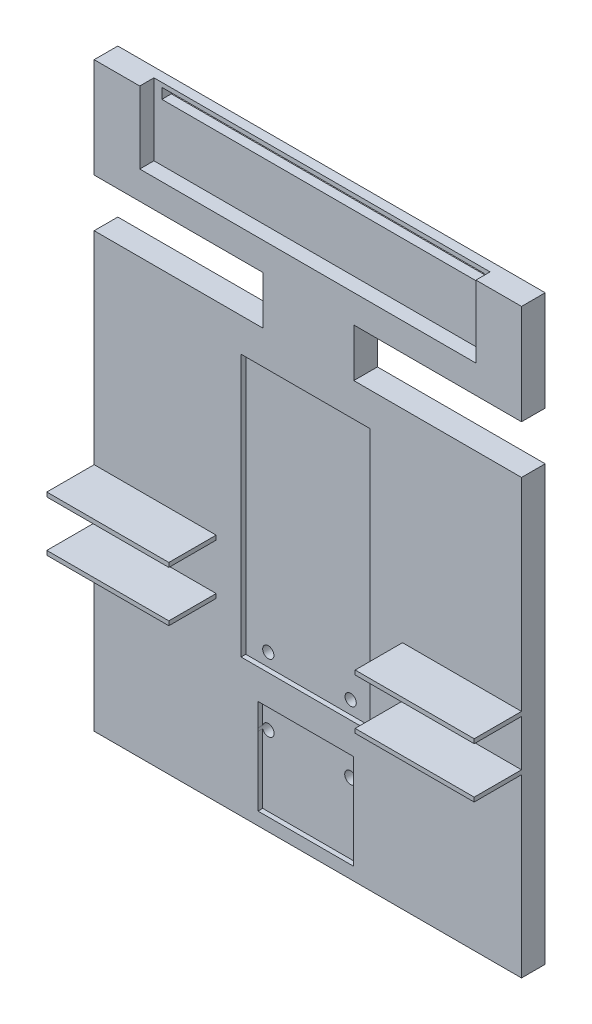
from build123d import *

# Parameters (mm, degrees)
RESSALTO_EXTRUS_O1_DEPTH = 5
ESBO_O2_W                = 71.017341725
ESBO_O2_H                = 15.188699459
CORTE_EXTRUS_O1_DEPTH    = 3
MOVER_FACE1_BY           = 10.718934909
ESBO_O3_W                = 68.089828176
ESBO_O3_H                = 2.204794608
CORTE_EXTRUS_O2_DEPTH    = 10
ESBO_O4_W                = 20.131000956
ESBO_O4_H                = 20.074327354
ESBO_O4_W_2              = 27.282150264
ESBO_O4_H_2              = 55.406342203
CORTE_EXTRUS_O4_DEPTH    = 1
ESBO_O5_R                = 1.188185025
ESBO_O5_R_2              = 1.258078261
ESBO_O5_R_3              = 1.220632904
CORTE_EXTRUS_O5_DEPTH    = 10
ESBO_O6_W                = 25.148684125
ESBO_O6_H                = 11.582759477
ESBO_O6_W_2              = 25.779007711
RESSALTO_EXTRUS_O2_DEPTH = 10
ESBO_O7_W                = 10
ESBO_O7_H                = 9.769511044
CORTE_EXTRUS_O7_DEPTH    = 99


with BuildPart() as part:
    # Esboço1 → Ressalto-extrusão1 (new body)
    with BuildSketch(Plane.XY):
        Polygon((-44.67348187, 40.715072084), (-44.67348187, 19.603553226), (-9.047793796, 19.603553226), (-9.047793796, 9.424785205), (-44.67348187, 9.424785205), (-44.67348187, -71.439871851), (45.61596039, -71.439871851), (45.61596039, 9.424785205), (10.178768021, 9.424785205), (10.178768021, 19.603553226), (45.61596039, 19.603553226), (45.61596039, 40.715072084), align=None)
    extrude(amount=RESSALTO_EXTRUS_O1_DEPTH)

    # Esboço2 → Corte-extrusão1 (cut)
    with BuildSketch(Plane.XY.offset(5)):
        with Locations((0.47123926, 33.120722355)):
            Rectangle(ESBO_O2_W, ESBO_O2_H)
    extrude(amount=-CORTE_EXTRUS_O1_DEPTH, mode=Mode.SUBTRACT)

    # Mover face1: a face moved outward by 10.718935
    extrude(part.faces().sort_by_distance((0.47123926, -71.439871851, 2.5))[0], amount=MOVER_FACE1_BY, dir=(0, -1, 0))

    # Esboço3 → Corte-extrusão2 (cut)
    with BuildSketch(Plane.XY.offset(2)):
        with Locations((0.67810757, 38.709026673)):
            Rectangle(ESBO_O3_W, ESBO_O3_H)
    extrude(amount=-CORTE_EXTRUS_O2_DEPTH, mode=Mode.SUBTRACT)

    # Esboço4 → Corte-extrusão4 (cut)
    with BuildSketch(Plane.XY.offset(5)):
        with Locations((0.001720335, -69.421605448)):
            Rectangle(ESBO_O4_W, ESBO_O4_H)
        with Locations((0.003895482, -25.35309655)):
            Rectangle(ESBO_O4_W_2, ESBO_O4_H_2)
    extrude(amount=-CORTE_EXTRUS_O4_DEPTH, mode=Mode.SUBTRACT)

    # Esboço5 → Corte-extrusão5 (cut)
    with BuildSketch(Plane(origin=(0, 0, 0), x_dir=(-1, 0, 0), z_dir=(0, 0, -1))):
        with Locations((-8.517583176, -50.2919249)):
            Circle(ESBO_O5_R)
        with Locations((-8.517583176, -64.550145197)):
            Circle(ESBO_O5_R_2)
        with Locations((8.885832774, -64.550145197)):
            Circle(ESBO_O5_R_3)
        with Locations((8.885832774, -50.2919249)):
            Circle(ESBO_O5_R)
    extrude(amount=-CORTE_EXTRUS_O5_DEPTH, mode=Mode.SUBTRACT)

    # Esboço6 → Ressalto-extrusão2 (add)
    with BuildSketch(Plane.XY.offset(5)):
        with Locations((33.041618328, -39.175755318)):
            Rectangle(ESBO_O6_W, ESBO_O6_H)
        with Locations((-31.783978015, -39.175755318)):
            Rectangle(ESBO_O6_W_2, ESBO_O6_H)
    extrude(amount=RESSALTO_EXTRUS_O2_DEPTH)

    # Esboço7 → Corte-extrusão7 (cut)
    with BuildSketch(Plane(origin=(45.61596039, 0, 0), x_dir=(0, 0, -1), z_dir=(1, 0, 0))):
        with Locations((-10, -39.181904772)):
            Rectangle(ESBO_O7_W, ESBO_O7_H)
    extrude(amount=-CORTE_EXTRUS_O7_DEPTH, mode=Mode.SUBTRACT)


solid = part.part
